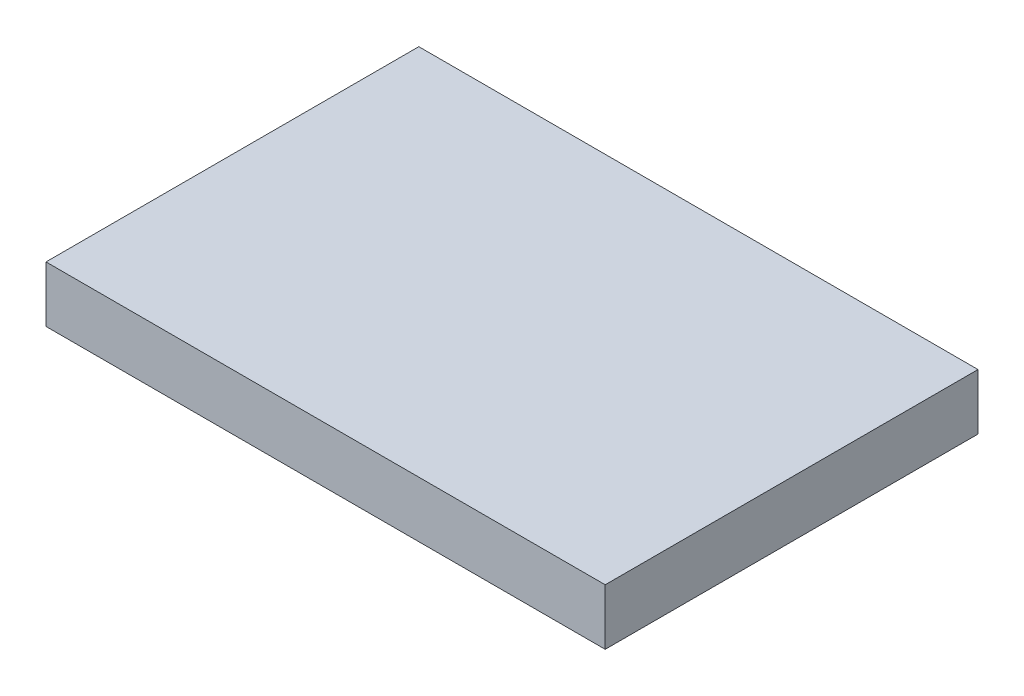
from build123d import *

# Parameters (mm, degrees)
SKETCH_1_W      = 30
SKETCH_1_H      = 20
EXTRUDE_1_DEPTH = 3


with BuildPart() as part:
    # 草图1 → 凸台-拉伸1 (new body)
    with BuildSketch(Plane(origin=(0, 0, 0), x_dir=(1, 0, 0), z_dir=(0, 1, 0))):
        with Locations((-23.022089253, -14.975293921)):
            Rectangle(SKETCH_1_W, SKETCH_1_H)
    extrude(amount=EXTRUDE_1_DEPTH)


solid = part.part
